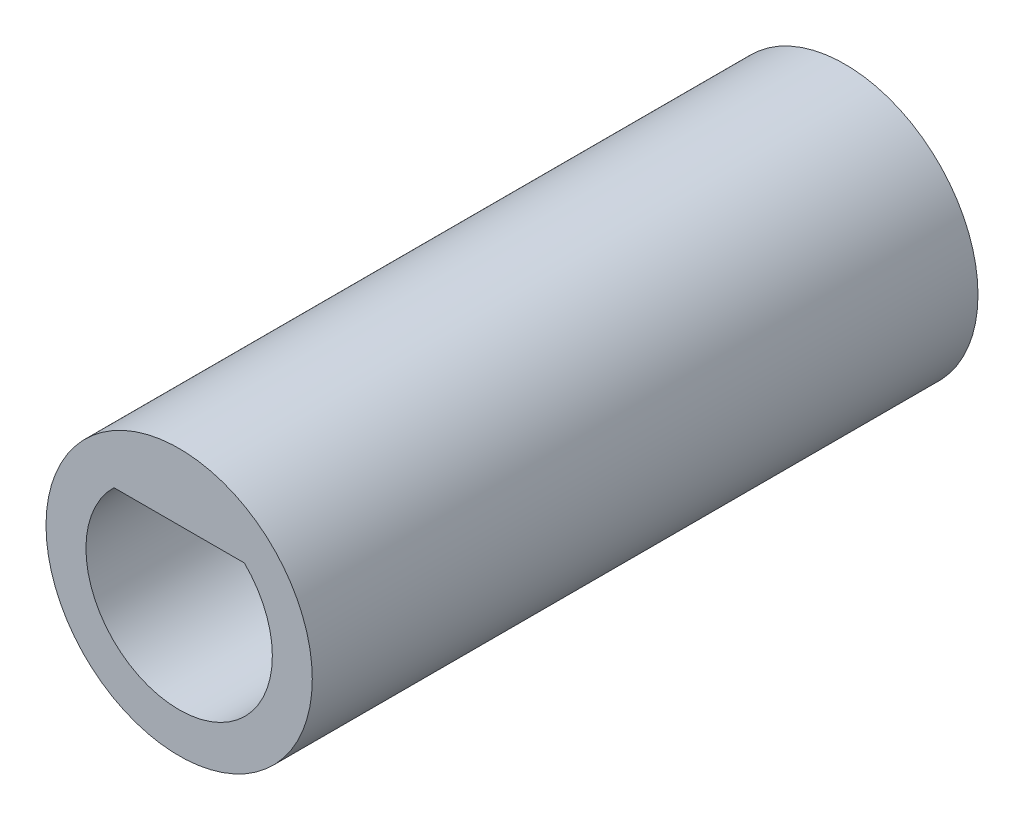
from build123d import *

# Parameters (mm, degrees)
SKETCH_1_R          = 3
EXTRUDE_1_DEPTH     = 15
CUT_EXTRUDE_1_DEPTH = 6
SKETCH_3_W          = 1
SKETCH_3_H          = 1.75
SKETCH_3_W_2        = 1.75
SKETCH_3_H_2        = 1
CUT_EXTRUDE_2_DEPTH = 8
FILLET_2_R          = 0.2


with BuildPart() as part:
    # 草图1 → 凸台-拉伸1 (new body)
    with BuildSketch(Plane.XY):
        Circle(SKETCH_1_R)
    extrude(amount=EXTRUDE_1_DEPTH)

    # 草图2 → 切除-拉伸1 (cut)
    with BuildSketch(Plane.XY.offset(15)):
        with BuildLine():
            Line((1.469693846, 1.5), (-1.469693846, 1.5))
            ThreePointArc((-1.469693846, 1.5), (-0.8135241, -1.936021317), (2.1, 0))
            ThreePointArc((2.1, 0), (1.936021317, 0.8135241), (1.469693846, 1.5))
        make_face()
    extrude(amount=-CUT_EXTRUDE_1_DEPTH, mode=Mode.SUBTRACT)

    # 草图3 → 切除-拉伸2 (cut)
    with BuildSketch(Plane(origin=(0, 0, 0), x_dir=(-1, 0, 0), z_dir=(0, 0, -1))):
        with Locations((0, -1.375)):
            Rectangle(SKETCH_3_W, SKETCH_3_H)
        with Locations((1.375, 0)):
            Rectangle(SKETCH_3_W_2, SKETCH_3_H_2)
        Rectangle(SKETCH_3_W, SKETCH_3_H_2)
        with Locations((-1.375, 0)):
            Rectangle(SKETCH_3_W_2, SKETCH_3_H_2)
        with Locations((0, 1.375)):
            Rectangle(SKETCH_3_W, SKETCH_3_H)
    extrude(amount=-CUT_EXTRUDE_2_DEPTH, mode=Mode.SUBTRACT)

    # 圆角2
    fillet_2_edges = [part.edges().sort_by_distance(p)[0] for p in [
        (-0.5, -1.375, 8),
        (-0.5, -0.5, 4),
        (0, -2.25, 0),
        (-0.5, -2.25, 4),
        (0.5, -1.375, 0),
        (0.5, -2.25, 4),
        (1.375, -0.5, 8),
        (0.5, -0.5, 4),
        (2.25, 0, 0),
        (2.25, -0.5, 4),
        (1.375, 0.5, 0),
        (2.25, 0.5, 4),
        (0.5, 1.375, 0),
        (0.5, 0.5, 4),
        (0, 2.25, 8),
        (0.5, 2.25, 4),
        (-0.5, 1.375, 8),
        (-0.5, 2.25, 4),
        (-1.375, 0.5, 0),
        (-0.5, 0.5, 4),
        (-2.25, 0, 8),
        (-2.25, 0.5, 4),
        (-1.375, -0.5, 8),
        (-2.25, -0.5, 4),
        (0, -2.25, 8),
        (0.5, -1.375, 8),
        (2.25, 0, 8),
        (1.375, 0.5, 8),
        (0.5, 1.375, 8),
        (-1.375, 0.5, 8),
        (-0.5, -1.375, 0),
        (-1.375, -0.5, 0),
        (-2.25, 0, 0),
        (-0.5, 1.375, 0),
        (0, 2.25, 0),
        (1.375, -0.5, 0),
    ]]
    fillet(fillet_2_edges, radius=FILLET_2_R)


solid = part.part
